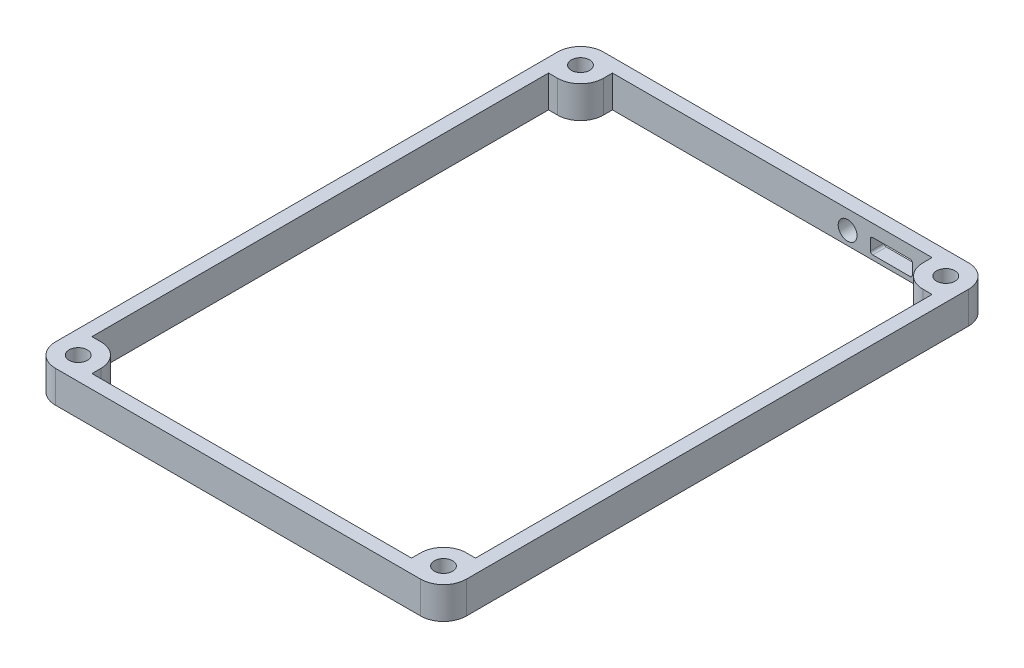
from build123d import *

# Parameters (mm, degrees)
SKETCH_3_W          = 90
SKETCH_3_H          = 120
SKETCH_3_R          = 2
EXTRUDE_2_DEPTH     = 7
FILLET_1_R          = 5
FILLET_2_R          = 5
FILLET_3_R          = 5
FILLET_4_R          = 5
FILLET_5_R          = 5
FILLET_6_R          = 5
SKETCH_4_W          = 9.2
SKETCH_4_H          = 3.3
CUT_EXTRUDE_1_DEPTH = 3
FILLET_7_R          = 0.5
FILLET_8_R          = 0.5
FILLET_9_R          = 0.5
FILLET_10_R         = 0.5
SKETCH_5_R          = 2.058488494
CUT_EXTRUDE_2_DEPTH = 3


with BuildPart() as part:
    # 草图3 → 凸台-拉伸2 (new body)
    with BuildSketch(Plane(origin=(0, 0, 0), x_dir=(-1, 0, 0), z_dir=(0, 1, 0))):
        Rectangle(SKETCH_3_W, SKETCH_3_H)
        with Locations(Location((40, 55, 0), (0, 0, 90))):
            Circle(SKETCH_3_R, mode=Mode.SUBTRACT)
        with Locations(Location((40, -55, 0), (0, 0, 90))):
            Circle(SKETCH_3_R, mode=Mode.SUBTRACT)
        with Locations(Location((-40, -55, 0), (0, 0, 90))):
            Circle(SKETCH_3_R, mode=Mode.SUBTRACT)
        with Locations(Location((-40, 55, 0), (0, 0, 90))):
            Circle(SKETCH_3_R, mode=Mode.SUBTRACT)
        Polygon((-42, -50), (-42, 50), (-35, 50), (-35, 57), (35, 57), (35, 50), (42, 50), (42, -50), (35, -50), (35, -57), (-35, -57), (-35, -50), align=None, mode=Mode.SUBTRACT)
    extrude(amount=EXTRUDE_2_DEPTH)

    # 圆角1
    fillet_1_edges = [part.edges().sort_by_distance(p)[0] for p in [
        (45, 3.5, -60),
        (45, 3.5, 60),
        (-45, 3.5, 60),
    ]]
    fillet(fillet_1_edges, radius=FILLET_1_R)

    # 圆角2
    fillet_2_edges = [part.edges().sort_by_distance(p)[0] for p in [
        (-45, 3.5, -60),
    ]]
    fillet(fillet_2_edges, radius=FILLET_2_R)

    # 圆角3
    fillet_3_edges = [part.edges().sort_by_distance(p)[0] for p in [
        (35, 3.5, -50),
    ]]
    fillet(fillet_3_edges, radius=FILLET_3_R)

    # 圆角4
    fillet_4_edges = [part.edges().sort_by_distance(p)[0] for p in [
        (-35, 3.5, -50),
    ]]
    fillet(fillet_4_edges, radius=FILLET_4_R)

    # 圆角5
    fillet_5_edges = [part.edges().sort_by_distance(p)[0] for p in [
        (35, 3.5, 50),
    ]]
    fillet(fillet_5_edges, radius=FILLET_5_R)

    # 圆角6
    fillet_6_edges = [part.edges().sort_by_distance(p)[0] for p in [
        (-35, 3.5, 50),
    ]]
    fillet(fillet_6_edges, radius=FILLET_6_R)

    # 草图4 → 切除-拉伸1 (cut)
    with BuildSketch(Plane(origin=(0, 0, -60), x_dir=(-1, 0, 0), z_dir=(0, 0, -1))):
        with Locations((-26.1, 2.65)):
            Rectangle(SKETCH_4_W, SKETCH_4_H)
    extrude(amount=-CUT_EXTRUDE_1_DEPTH, mode=Mode.SUBTRACT)

    # 圆角7
    fillet_7_edges = [part.edges().sort_by_distance(p)[0] for p in [
        (21.5, 1, -58.5),
    ]]
    fillet(fillet_7_edges, radius=FILLET_7_R)

    # 圆角8
    fillet_8_edges = [part.edges().sort_by_distance(p)[0] for p in [
        (21.5, 4.3, -58.5),
    ]]
    fillet(fillet_8_edges, radius=FILLET_8_R)

    # 圆角9
    fillet_9_edges = [part.edges().sort_by_distance(p)[0] for p in [
        (30.7, 1, -58.5),
    ]]
    fillet(fillet_9_edges, radius=FILLET_9_R)

    # 圆角10
    fillet_10_edges = [part.edges().sort_by_distance(p)[0] for p in [
        (30.7, 4.3, -58.5),
    ]]
    fillet(fillet_10_edges, radius=FILLET_10_R)

    # 草图5 → 切除-拉伸2 (cut)
    with BuildSketch(Plane(origin=(0, 0, -60), x_dir=(-1, 0, 0), z_dir=(0, 0, -1))):
        with Locations((-16.5, 2.913308791)):
            Circle(SKETCH_5_R)
    extrude(amount=-CUT_EXTRUDE_2_DEPTH, mode=Mode.SUBTRACT)


solid = part.part
